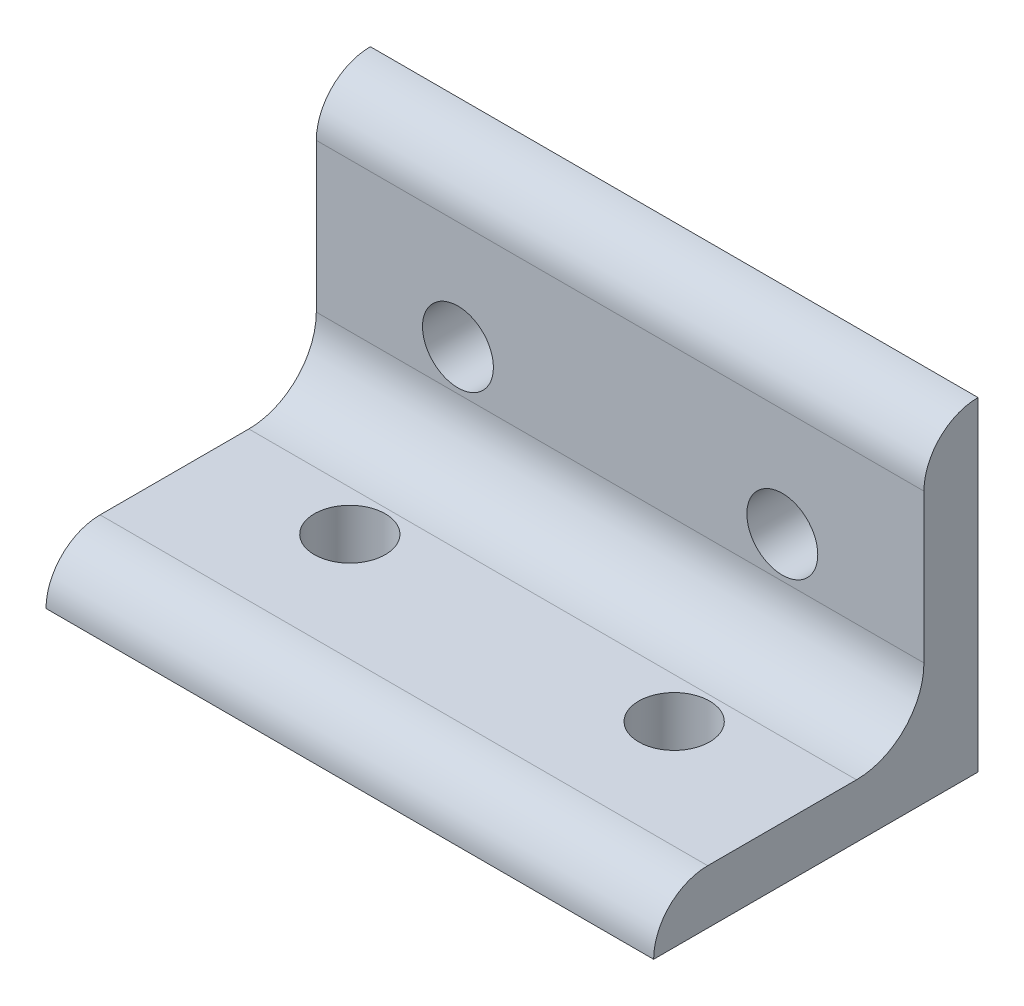
from build123d import *

# Parameters (mm, degrees)
BOSS_EXTRUDE1_DEPTH = 71.374
HOLE1_D             = 8.3312
HOLE2_D             = 8.3312
FILLET1_R           = 7.9248


with BuildPart() as part:
    # Sketch1 → Boss-Extrude1 (new body)
    with BuildSketch(Plane(origin=(35.687, 0, 0), x_dir=(0, 0, -1), z_dir=(1, 0, 0))):
        with BuildLine():
            Line((-38.1, 0), (0, 0))
            Line((0, 0), (0, 38.1))
            ThreePointArc((0, 38.1), (-4.490128061, 36.240128061), (-6.35, 31.75))
            Line((-6.35, 31.75), (-6.35, 6.35))
            Line((-6.35, 6.35), (-31.75, 6.35))
            ThreePointArc((-31.75, 6.35), (-36.240128061, 4.490128061), (-38.1, 0))
        make_face()
    extrude(amount=-BOSS_EXTRUDE1_DEPTH)

    # Hole1 (through all)
    with Locations(Plane.XY.offset(6.35)):
        with Locations((19.05, 19.05), (-19.05, 19.05)):
            Hole(HOLE1_D / 2)

    # Hole2 (through all)
    with Locations(Plane(origin=(0, 6.35, 0), x_dir=(1, 0, 0), z_dir=(0, 1, 0))):
        with Locations((19.05, -19.05), (-19.05, -19.05)):
            Hole(HOLE2_D / 2)

    # Fillet1
    fillet1_edges = [part.edges().sort_by_distance(p)[0] for p in [
        (0, 6.35, 6.35),
    ]]
    fillet(fillet1_edges, radius=FILLET1_R)


solid = part.part
